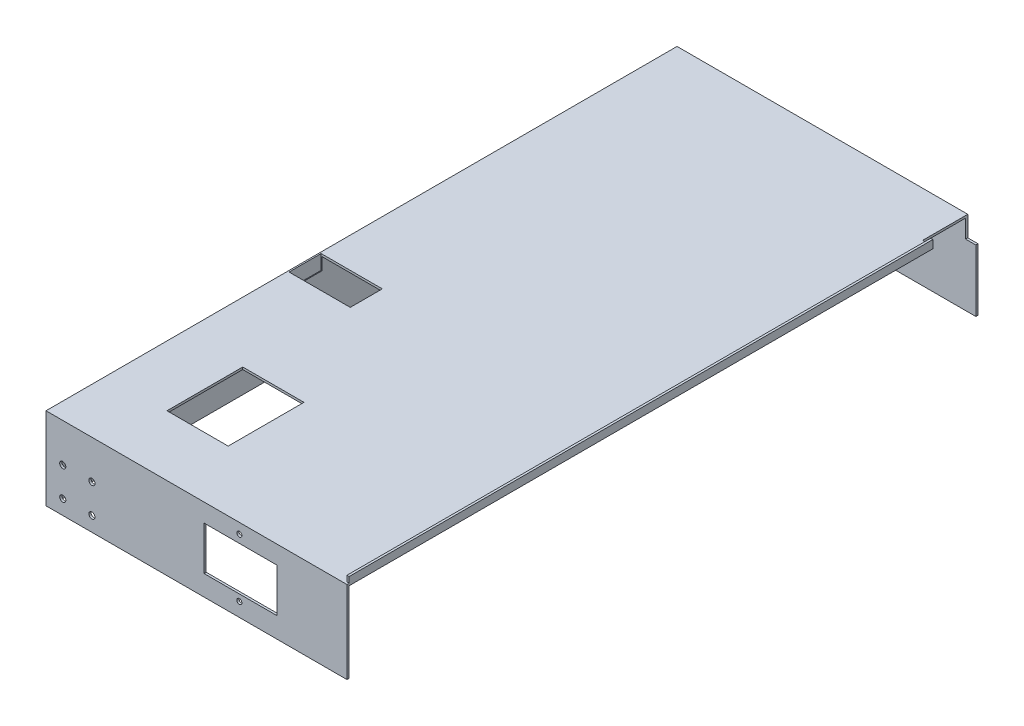
from build123d import *

# Parameters (mm, degrees)
SKETCH4_W                = 42
SKETCH4_H                = 52
BOSS_EXTRUDE4_DEPTH      = 1.5
BOSS_EXTRUDE5_DEPTH      = 1.5
BOSS_EXTRUDE5_DEPTH_BACK = 0.0001
SKETCH5_W                = 205
SKETCH5_H                = 56.5
SKETCH8_W                = 1.5
SKETCH8_H                = 430
BOSS_EXTRUDE14_DEPTH     = 4
SKETCH7_W                = 205
SKETCH7_H                = 56.5
BOSS_EXTRUDE18_DEPTH     = 1.5
SKETCH9_W                = 433
SKETCH9_H                = 56.5
BOSS_EXTRUDE19_DEPTH     = 1.5
SKETCH15_R               = 2.1
CUT_EXTRUDE1_DEPTH       = 10
CUT_EXTRUDE2_START       = -10
SKETCH14_R               = 2.1
CUT_EXTRUDE2_DEPTH       = 10
CUT_EXTRUDE3_START       = -10
SKETCH12_R               = 2.1
CUT_EXTRUDE3_DEPTH       = 10
CUT_EXTRUDE4_START       = -10
SKETCH10_R               = 2.1
CUT_EXTRUDE4_DEPTH       = 10
CUT_EXTRUDE5_START       = -10
SKETCH11_R               = 2.1
CUT_EXTRUDE5_DEPTH       = 10
SKETCH17_W               = 42
SKETCH17_H               = 22
CUT_EXTRUDE6_DEPTH       = 10
SKETCH18_W               = 50.068809171
SKETCH18_H               = 30
CUT_EXTRUDE7_DEPTH       = 10
SKETCH19_R               = 1.75
CUT_EXTRUDE8_DEPTH       = 10
SKETCH23_W               = 7
SKETCH23_H               = 18
CUT_EXTRUDE10_DEPTH      = 31


with BuildPart() as part:
    # Sketch4 → Boss-Extrude4 (new body)
    with BuildSketch(Plane(origin=(0, 0, 0), x_dir=(1, 0, 0), z_dir=(0, 1, 0))):
        Polygon((139.373653762, 430), (344.373653762, 430), (344.373653762, 0), (139.373653762, 0), (139.373653762, 65), (139.373653762, 230), align=None)
        with Locations((200.373653762, 66)):
            Rectangle(SKETCH4_W, SKETCH4_H, mode=Mode.SUBTRACT)
    extrude(amount=BOSS_EXTRUDE4_DEPTH)

    # Sketch5 → Boss-Extrude5 (add, two sides: drawn at the far end of the back side and taken through both)
    with BuildSketch(Plane.XY.offset(-BOSS_EXTRUDE5_DEPTH_BACK)):
        with Locations((241.873653762, -26.75)):
            Rectangle(SKETCH5_W, SKETCH5_H)
    extrude(amount=BOSS_EXTRUDE5_DEPTH + BOSS_EXTRUDE5_DEPTH_BACK)

    # Sketch8 → Boss-Extrude14 (add)
    with BuildSketch(Plane(origin=(0, 1.5, 0), x_dir=(1, 0, 0), z_dir=(0, 1, 0))):
        with Locations((343.623653762, 215)):
            Rectangle(SKETCH8_W, SKETCH8_H)
    extrude(amount=BOSS_EXTRUDE14_DEPTH)

    # Sketch7 → Boss-Extrude18 (add)
    with BuildSketch(Plane(origin=(0, 0, -430), x_dir=(-1, 0, 0), z_dir=(0, 0, -1))):
        with Locations((-241.873653762, -26.75)):
            Rectangle(SKETCH7_W, SKETCH7_H)
    extrude(amount=BOSS_EXTRUDE18_DEPTH)

    # Sketch9 → Boss-Extrude19 (add)
    with BuildSketch(Plane.ZY.offset(-139.373653762)):
        with Locations((-215, -26.75)):
            Rectangle(SKETCH9_W, SKETCH9_H)
    extrude(amount=BOSS_EXTRUDE19_DEPTH)

    # Sketch15 → Cut-Extrude1 (cut)
    with BuildSketch(Plane(origin=(0, 0, -431.5), x_dir=(-1, 0, 0), z_dir=(0, 0, -1))):
        with Locations((-169.373653762, -25)):
            Circle(SKETCH15_R)
        with Locations((-149.373653762, -25)):
            Circle(SKETCH15_R)
        with Locations((-169.373653762, -45)):
            Circle(SKETCH15_R)
        with Locations((-149.373653762, -45)):
            Circle(SKETCH15_R)
    extrude(amount=-CUT_EXTRUDE1_DEPTH, mode=Mode.SUBTRACT)

    # Sketch14 → Cut-Extrude2 (cut)
    with BuildSketch(Plane.XY.offset(1.5).offset(CUT_EXTRUDE2_START)):
        with Locations(Location((169.373653762, -25, 0), (0, 0, 180))):
            Circle(SKETCH14_R)
    extrude(amount=CUT_EXTRUDE2_DEPTH, mode=Mode.SUBTRACT)

    # Sketch12 → Cut-Extrude3 (cut)
    with BuildSketch(Plane.XY.offset(1.5).offset(CUT_EXTRUDE3_START)):
        with Locations(Location((149.373653762, -25, 0), (0, 0, 180))):
            Circle(SKETCH12_R)
    extrude(amount=CUT_EXTRUDE3_DEPTH, mode=Mode.SUBTRACT)

    # Sketch10 → Cut-Extrude4 (cut)
    with BuildSketch(Plane.XY.offset(1.5).offset(CUT_EXTRUDE4_START)):
        with Locations(Location((169.373653762, -45, 0), (0, 0, 180))):
            Circle(SKETCH10_R)
    extrude(amount=CUT_EXTRUDE4_DEPTH, mode=Mode.SUBTRACT)

    # Sketch11 → Cut-Extrude5 (cut)
    with BuildSketch(Plane.XY.offset(1.5).offset(CUT_EXTRUDE5_START)):
        with Locations(Location((149.373653762, -45, 0), (0, 0, 180))):
            Circle(SKETCH11_R)
    extrude(amount=CUT_EXTRUDE5_DEPTH, mode=Mode.SUBTRACT)

    # Sketch17 → Cut-Extrude6 (cut)
    with BuildSketch(Plane(origin=(0, 1.5, 0), x_dir=(1, 0, 0), z_dir=(0, 1, 0))):
        with Locations((159.837104003, 175.311739833)):
            Rectangle(SKETCH17_W, SKETCH17_H)
    extrude(amount=-CUT_EXTRUDE6_DEPTH, mode=Mode.SUBTRACT)

    # Sketch18 → Cut-Extrude7 (cut)
    with BuildSketch(Plane.XY.offset(1.5)):
        with Locations((271.339249177, -26)):
            Rectangle(SKETCH18_W, SKETCH18_H)
    extrude(amount=-CUT_EXTRUDE7_DEPTH, mode=Mode.SUBTRACT)

    # Sketch19 → Cut-Extrude8 (cut)
    with BuildSketch(Plane.XY.offset(1.5)):
        with Locations((270.543410902, -5.5)):
            Circle(SKETCH19_R)
        with Locations((270.543410902, -45.5)):
            Circle(SKETCH19_R)
    extrude(amount=-CUT_EXTRUDE8_DEPTH, mode=Mode.SUBTRACT)

    # Sketch23 → Cut-Extrude10 (cut)
    with BuildSketch(Plane(origin=(0, 0, -431.5), x_dir=(-1, 0, 0), z_dir=(0, 0, -1))):
        with Locations((-340.873653762, -3.5)):
            Rectangle(SKETCH23_W, SKETCH23_H)
    extrude(amount=-CUT_EXTRUDE10_DEPTH, mode=Mode.SUBTRACT)


solid = part.part
